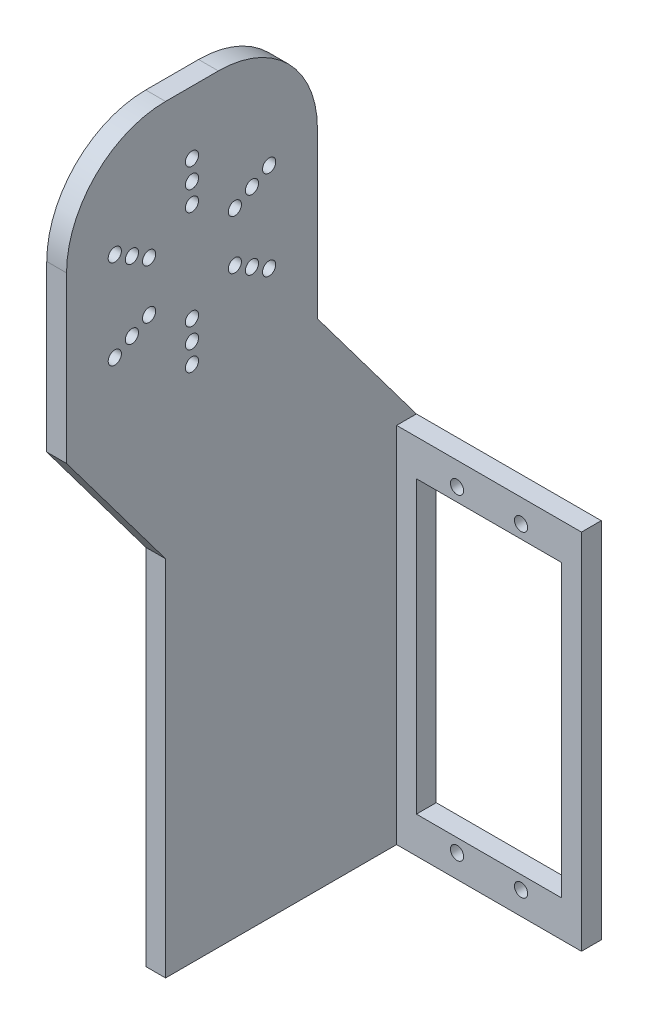
from build123d import *

# Parameters (mm, degrees)
SKETCH1_W           = 31
SKETCH1_H           = 55
SKETCH1_R           = 1
SKETCH1_W_2         = 22
SKETCH1_H_2         = 44
BOSS_EXTRUDE1_DEPTH = 3
SKETCH2_W           = 3
SKETCH2_H           = 55
BOSS_EXTRUDE2_DEPTH = 35
SKETCH3_W           = 3
SKETCH3_H           = 53
BOSS_EXTRUDE3_DEPTH = 20
CUT_EXTRUDE1_DEPTH  = 3
SKETCH5_W           = 3
SKETCH5_H           = 38
BOSS_EXTRUDE4_DEPTH = 40
SKETCH6_R           = 1
CUT_EXTRUDE2_DEPTH  = 3
FILLET1_R           = 15


with BuildPart() as part:
    # Sketch1 → Boss-Extrude1 (new body)
    with BuildSketch(Plane.XY):
        with Locations((-1.5, 0)):
            Rectangle(SKETCH1_W, SKETCH1_H)
        with Locations((-4.85, -24)):
            Circle(SKETCH1_R, mode=Mode.SUBTRACT)
        with Locations((4.85, -24)):
            Circle(SKETCH1_R, mode=Mode.SUBTRACT)
        with Locations((4.85, 24)):
            Circle(SKETCH1_R, mode=Mode.SUBTRACT)
        with Locations((-4.85, 24)):
            Circle(SKETCH1_R, mode=Mode.SUBTRACT)
        Rectangle(SKETCH1_W_2, SKETCH1_H_2, mode=Mode.SUBTRACT)
    extrude(amount=BOSS_EXTRUDE1_DEPTH)

    # Sketch2 → Boss-Extrude2 (add)
    with BuildSketch(Plane.XY.offset(3)):
        with Locations((-15.5, 0)):
            Rectangle(SKETCH2_W, SKETCH2_H)
    extrude(amount=BOSS_EXTRUDE2_DEPTH)

    # Sketch3 → Boss-Extrude3 (add)
    with BuildSketch(Plane(origin=(0, 27.5, 0), x_dir=(1, 0, 0), z_dir=(0, 1, 0))):
        with Locations((-15.5, -26.5)):
            Rectangle(SKETCH3_W, SKETCH3_H)
    extrude(amount=BOSS_EXTRUDE3_DEPTH)

    # Sketch4 → Cut-Extrude1 (cut)
    with BuildSketch(Plane.ZY.offset(17)):
        Polygon((53, 27.5), (38, 27.5), (53, 47.5), align=None)
        Polygon((0, 27.5), (0, 47.5), (15, 47.5), align=None)
    extrude(amount=-CUT_EXTRUDE1_DEPTH, mode=Mode.SUBTRACT)

    # Sketch5 → Boss-Extrude4 (add)
    with BuildSketch(Plane(origin=(0, 47.5, 0), x_dir=(1, 0, 0), z_dir=(0, 1, 0))):
        with Locations((-15.5, -34)):
            Rectangle(SKETCH5_W, SKETCH5_H)
    extrude(amount=BOSS_EXTRUDE4_DEPTH)

    # Sketch6 → Cut-Extrude2 (cut)
    with BuildSketch(Plane.ZY.offset(17)):
        with Locations((34, 72)):
            Circle(SKETCH6_R)
        with Locations((34, 75)):
            Circle(SKETCH6_R)
        with Locations((34, 78)):
            Circle(SKETCH6_R)
        with Locations((45.691342951, 71.25)):
            Circle(SKETCH6_R)
        with Locations((43.09326674, 69.75)):
            Circle(SKETCH6_R)
        with Locations((40.495190528, 68.25)):
            Circle(SKETCH6_R)
        with Locations((45.691342951, 57.75)):
            Circle(SKETCH6_R)
        with Locations((43.09326674, 59.25)):
            Circle(SKETCH6_R)
        with Locations((40.495190528, 60.75)):
            Circle(SKETCH6_R)
        with Locations((34, 51)):
            Circle(SKETCH6_R)
        with Locations((34, 54)):
            Circle(SKETCH6_R)
        with Locations((34, 57)):
            Circle(SKETCH6_R)
        with Locations((22.308657049, 57.75)):
            Circle(SKETCH6_R)
        with Locations((24.90673326, 59.25)):
            Circle(SKETCH6_R)
        with Locations((27.504809472, 60.75)):
            Circle(SKETCH6_R)
        with Locations((22.308657049, 71.25)):
            Circle(SKETCH6_R)
        with Locations((24.90673326, 69.75)):
            Circle(SKETCH6_R)
        with Locations((27.504809472, 68.25)):
            Circle(SKETCH6_R)
    extrude(amount=-CUT_EXTRUDE2_DEPTH, mode=Mode.SUBTRACT)

    # Fillet1
    fillet1_edges = [part.edges().sort_by_distance(p)[0] for p in [
        (-15.5, 87.5, 53),
        (-15.5, 87.5, 15),
    ]]
    fillet(fillet1_edges, radius=FILLET1_R)


solid = part.part
